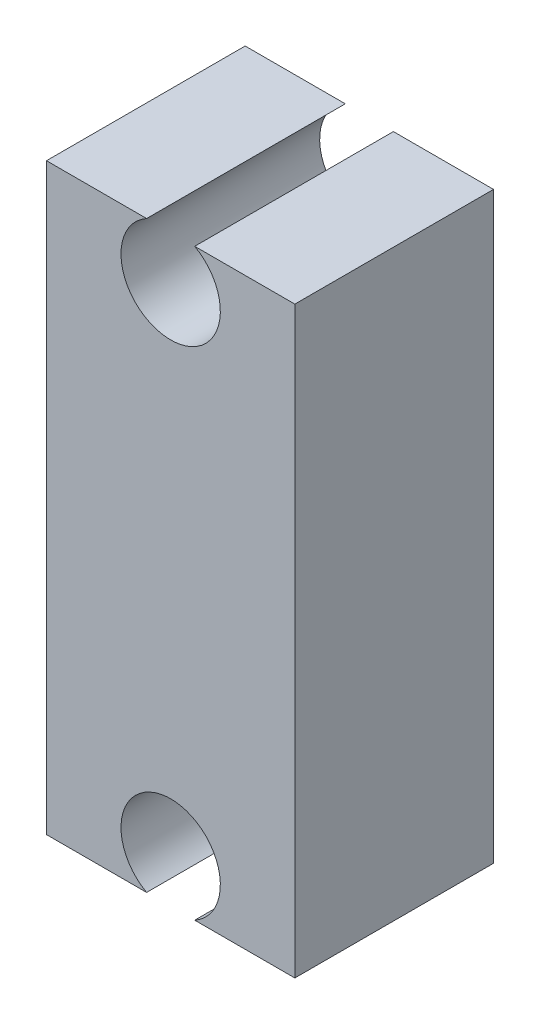
from build123d import *

# Parameters (mm, degrees)
SKETCH1_W           = 12.7
SKETCH1_H           = 29.845
BOSS_EXTRUDE1_DEPTH = 10.16
SKETCH2_R           = 2.54
CUT_EXTRUDE1_DEPTH  = 10.16


with BuildPart() as part:
    # Sketch1 → Boss-Extrude1 (new body)
    with BuildSketch(Plane.XY):
        with Locations((-6.35, -0.928981481)):
            Rectangle(SKETCH1_W, SKETCH1_H)
    extrude(amount=BOSS_EXTRUDE1_DEPTH)

    # Sketch2 → Cut-Extrude1 (cut)
    with BuildSketch(Plane.XY.offset(10.16)):
        with Locations((-6.35, 11.771018519)):
            Circle(SKETCH2_R)
        with Locations((-6.35, -13.628981481)):
            Circle(SKETCH2_R)
    extrude(amount=-CUT_EXTRUDE1_DEPTH, mode=Mode.SUBTRACT)


solid = part.part
